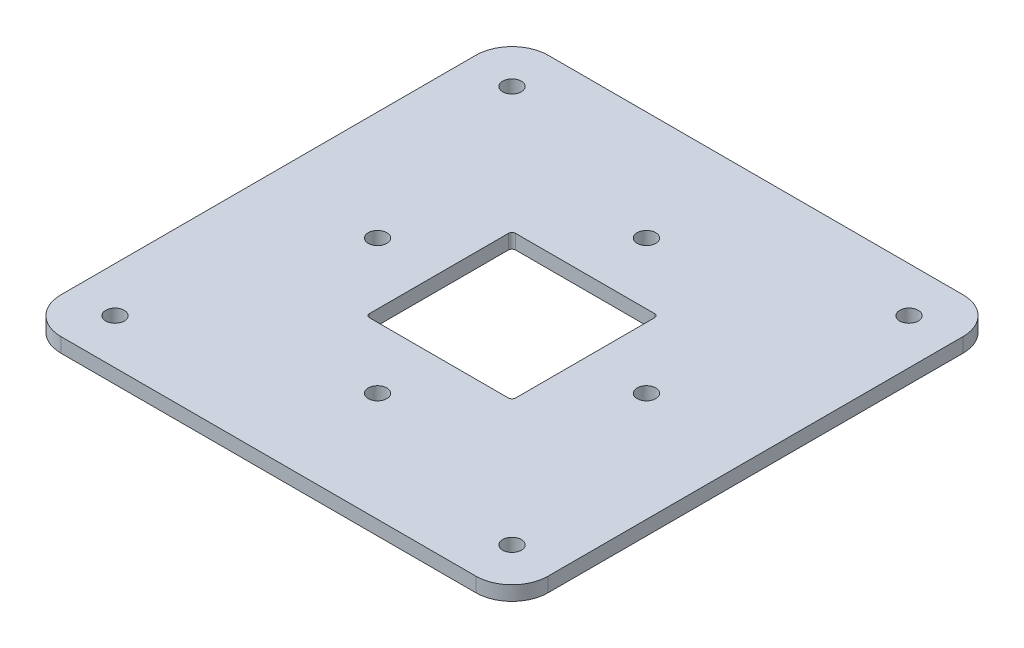
from build123d import *

# Parameters (mm, degrees)
SKETCH1_W           = 135
SKETCH1_H           = 135
BOSS_EXTRUDE1_DEPTH = 4
CUT_EXTRUDE1_DEPTH  = 96.543183954
SKETCH5_R           = 2.58
CUT_EXTRUDE2_DEPTH  = 96.543183954
SKETCH6_R           = 2.58
CUT_EXTRUDE3_DEPTH  = 96.543183954
FILLET1_R           = 10


with BuildPart() as part:
    # Sketch1 → Boss-Extrude1 (new body)
    with BuildSketch(Plane(origin=(0, 0, 0), x_dir=(1, 0, 0), z_dir=(0, 1, 0))):
        Rectangle(SKETCH1_W, SKETCH1_H)
    extrude(amount=BOSS_EXTRUDE1_DEPTH)

    # Sketch4 → Cut-Extrude1 (cut, through all)
    with BuildSketch(Plane(origin=(0, 4, 0), x_dir=(1, 0, 0), z_dir=(0, 1, 0))):
        with BuildLine():
            Line((-19.25, 20.25), (19.25, 20.25))
            ThreePointArc((19.25, 20.25), (19.957106781, 19.957106781), (20.25, 19.25))
            Line((20.25, 19.25), (20.25, -19.25))
            ThreePointArc((20.25, -19.25), (19.957106781, -19.957106781), (19.25, -20.25))
            Line((19.25, -20.25), (-19.25, -20.25))
            ThreePointArc((-19.25, -20.25), (-19.957106781, -19.957106781), (-20.25, -19.25))
            Line((-20.25, -19.25), (-20.25, 19.25))
            ThreePointArc((-20.25, 19.25), (-19.957106781, 19.957106781), (-19.25, 20.25))
        make_face()
    extrude(amount=-CUT_EXTRUDE1_DEPTH, mode=Mode.SUBTRACT)

    # Sketch5 → Cut-Extrude2 (cut, through all)
    with BuildSketch(Plane(origin=(0, 4, 0), x_dir=(1, 0, 0), z_dir=(0, 1, 0))):
        with Locations(Location((-37.25, 0, 0), (0, 0, 270))):
            Circle(SKETCH5_R)
        with Locations(Location((0, 37.25, 0), (0, 0, 270))):
            Circle(SKETCH5_R)
        with Locations(Location((37.25, 0, 0), (0, 0, 270))):
            Circle(SKETCH5_R)
        with Locations(Location((0, -37.25, 0), (0, 0, 270))):
            Circle(SKETCH5_R)
    extrude(amount=-CUT_EXTRUDE2_DEPTH, mode=Mode.SUBTRACT)

    # Sketch6 → Cut-Extrude3 (cut, through all)
    with BuildSketch(Plane(origin=(0, 4, 0), x_dir=(1, 0, 0), z_dir=(0, 1, 0))):
        with Locations(Location((-55, 55, 0), (0, 0, 270))):
            Circle(SKETCH6_R)
        with Locations(Location((55, 55, 0), (0, 0, 270))):
            Circle(SKETCH6_R)
        with Locations(Location((55, -55, 0), (0, 0, 270))):
            Circle(SKETCH6_R)
        with Locations(Location((-55, -55, 0), (0, 0, 270))):
            Circle(SKETCH6_R)
    extrude(amount=-CUT_EXTRUDE3_DEPTH, mode=Mode.SUBTRACT)

    # Fillet1
    fillet1_edges = [part.edges().sort_by_distance(p)[0] for p in [
        (67.5, 2, 67.5),
        (-67.5, 2, 67.5),
        (-67.5, 2, -67.5),
        (67.5, 2, -67.5),
    ]]
    fillet(fillet1_edges, radius=FILLET1_R)


solid = part.part
